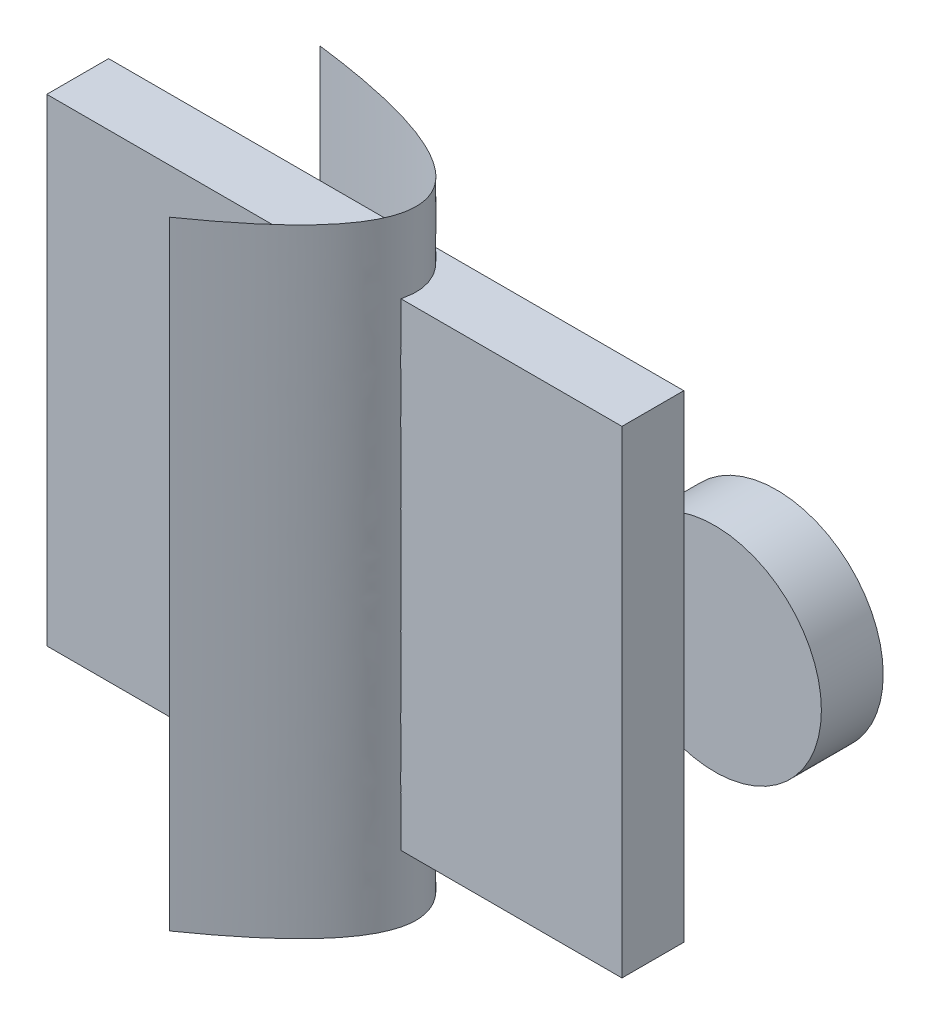
from build123d import *

# Parameters (mm, degrees)
F_1_FR_W        = 93.042145165
F_1_FR_H        = 77.277529207
EXTRUDE_1_DEPTH = 10
SKETCH_5_R      = 17.261773312
EXTRUDE_2_DEPTH = 10


with BuildPart() as part:
    # Эскиз1_fr → Бобышка-Вытянуть1 (new body)
    with BuildSketch(Plane.XY):
        with Locations((-2.472880935, -0.618220234)):
            Rectangle(F_1_FR_W, F_1_FR_H)
    extrude(amount=EXTRUDE_1_DEPTH)


with BuildPart() as body_2:
    # Эскиз5 → Бобышка-Вытянуть2 (new body)
    with BuildSketch(Plane.XY.offset(-5)):
        with Locations((44.048191648, -0.618220234)):
            Circle(SKETCH_5_R)
    extrude(amount=-EXTRUDE_2_DEPTH)


solid = Compound([part.part, body_2.part])
